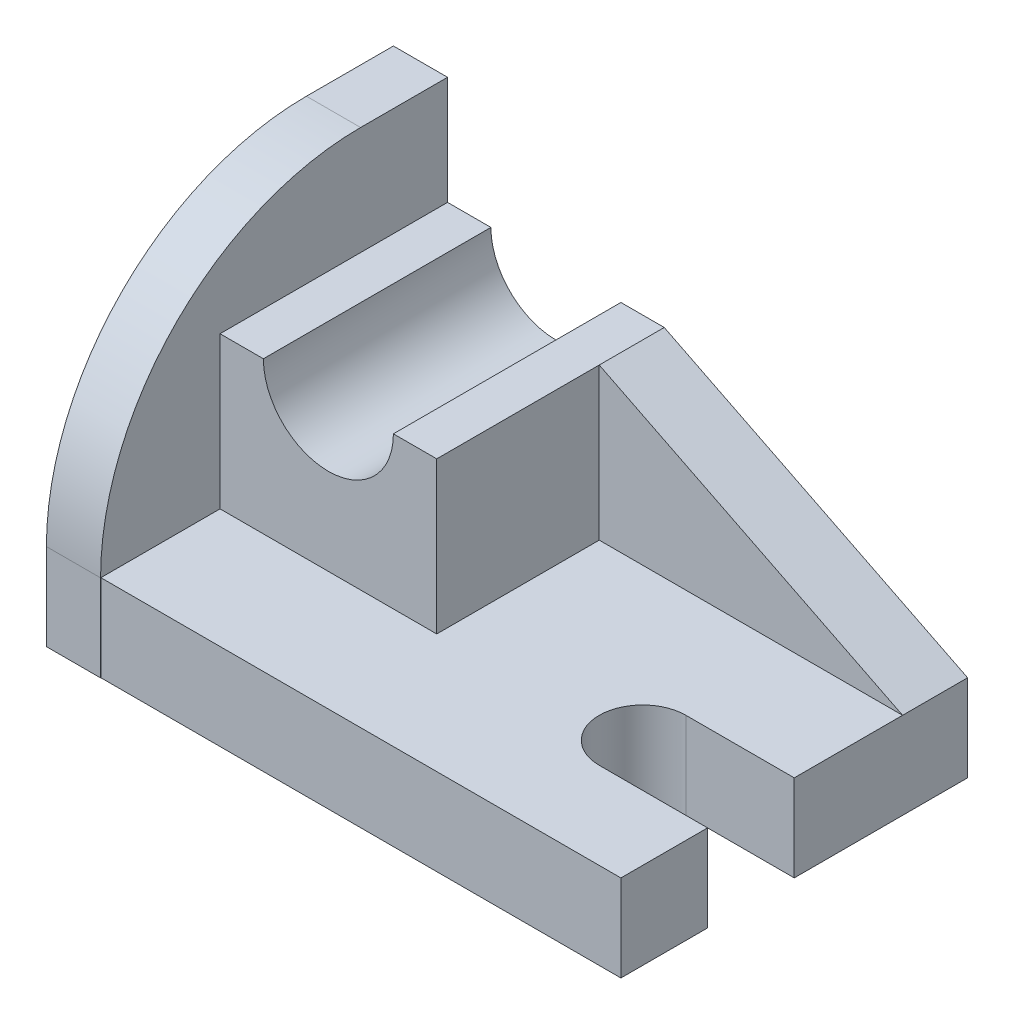
from build123d import *

# Parameters (mm, degrees)
SKETCH2_W           = 2438.4
SKETCH2_H           = 1625.6
BOSS_EXTRUDE1_DEPTH = 406.4
CUT_EXTRUDE1_DEPTH  = 2717.81148747
BOSS_EXTRUDE3_DEPTH = 254
SKETCH8_W           = 1016
SKETCH8_H           = 1066.8
BOSS_EXTRUDE4_DEPTH = 711.2
SKETCH9_R           = 304.8
CUT_EXTRUDE3_DEPTH  = 3129.955892197
BOSS_EXTRUDE6_DEPTH = 304.8


with BuildPart() as part:
    # Sketch2 → Boss-Extrude1 (new body)
    with BuildSketch(Plane(origin=(0, 0, 0), x_dir=(1, 0, 0), z_dir=(0, 1, 0))):
        with Locations((1232.274530831, 285.460589812)):
            Rectangle(SKETCH2_W, SKETCH2_H)
    extrude(amount=BOSS_EXTRUDE1_DEPTH)

    # Sketch4 → Cut-Extrude1 (cut, through all)
    with BuildSketch(Plane(origin=(0, 406.4, 0), x_dir=(1, 0, 0), z_dir=(0, 1, 0))):
        with BuildLine():
            Line((2451.474530831, -120.939410188), (1943.474530831, -120.939410188))
            ThreePointArc((1943.474530831, -120.939410188), (1740.274530831, 82.260589812), (1943.474530831, 285.460589812))
            Line((1943.474530831, 285.460589812), (2451.474530831, 285.460589812))
            ThreePointArc((2451.474530831, 285.460589812), (2654.674530831, 82.260589812), (2451.474530831, -120.939410188))
        make_face()
    extrude(amount=-CUT_EXTRUDE1_DEPTH, mode=Mode.SUBTRACT)

    # Sketch6 → Boss-Extrude3 (add)
    with BuildSketch(Plane.ZY.offset(-13.074530831)):
        with BuildLine():
            Line((-1098.260589812, 0), (528.72241694, 0))
            Line((528.72241694, 0), (528.72241694, 406.4))
            ThreePointArc((528.72241694, 406.4), (171.627004563, 1268.504587623), (-690.47758306, 1625.6))
            Line((-690.47758306, 1625.6), (-1098.260589812, 1625.6))
            Line((-1098.260589812, 1625.6), (-1098.260589812, 0))
        make_face()
    extrude(amount=BOSS_EXTRUDE3_DEPTH)

    # Sketch8 → Boss-Extrude4 (add)
    with BuildSketch(Plane(origin=(0, 406.4, 0), x_dir=(1, 0, 0), z_dir=(0, 1, 0))):
        with Locations((521.074530831, 564.860589812)):
            Rectangle(SKETCH8_W, SKETCH8_H)
    extrude(amount=BOSS_EXTRUDE4_DEPTH)

    # Sketch9 → Cut-Extrude3 (cut, through all)
    with BuildSketch(Plane.XY.offset(-31.460589812)):
        with Locations((521.074530831, 1117.6)):
            Circle(SKETCH9_R)
    extrude(amount=-CUT_EXTRUDE3_DEPTH, mode=Mode.SUBTRACT)

    # Sketch12 → Boss-Extrude6 (add)
    with BuildSketch(Plane(origin=(0, 0, -1098.260589812), x_dir=(-1, 0, 0), z_dir=(0, 0, -1))):
        Polygon((-2451.474530831, 406.4), (-1029.074530831, 1117.6), (-1029.074530831, 406.4), align=None)
    extrude(amount=-BOSS_EXTRUDE6_DEPTH)


solid = part.part
